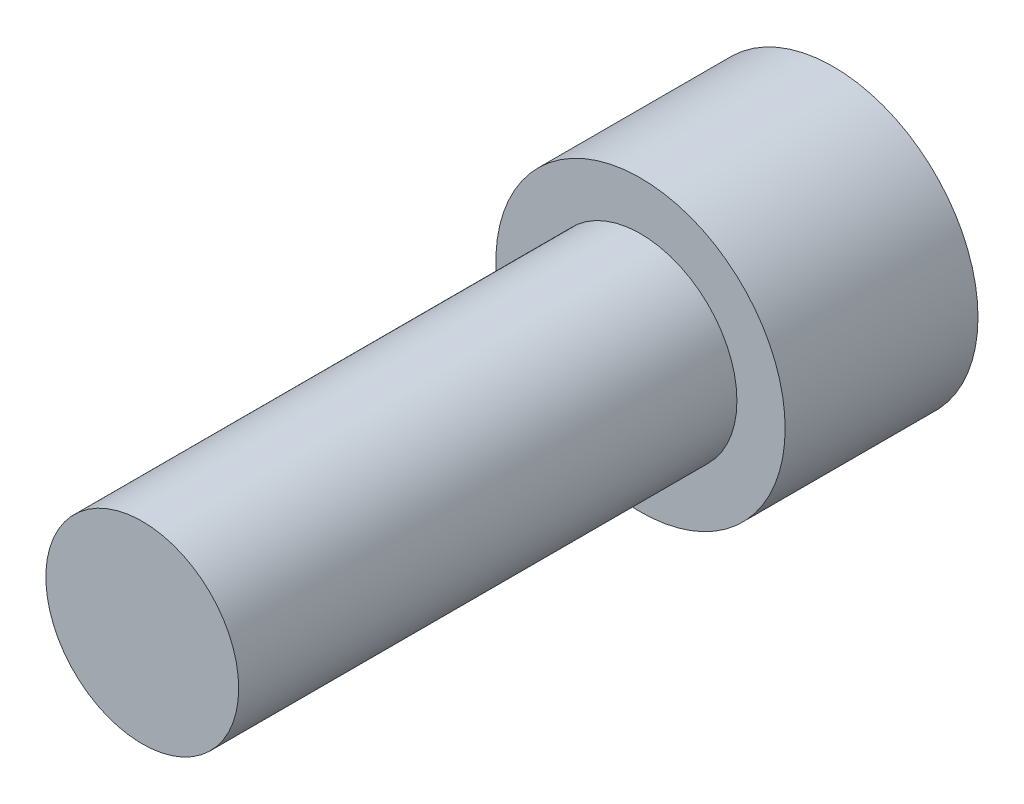
from build123d import *

# Parameters (mm, degrees)
SKETCH_1_R          = 9
EXTRUDE_1_DEPTH     = 12
SKETCH_2_R          = 6
EXTRUDE_2_DEPTH     = 31
CUT_EXTRUDE_1_DEPTH = 3


with BuildPart() as part:
    # ｽｹｯﾁ1 → ﾎﾞｽ - 押し出し1 (new body)
    with BuildSketch(Plane.XY):
        Circle(SKETCH_1_R)
    extrude(amount=EXTRUDE_1_DEPTH)

    # ｽｹｯﾁ2 → ﾎﾞｽ - 押し出し2 (add)
    with BuildSketch(Plane.XY.offset(12)):
        Circle(SKETCH_2_R)
    extrude(amount=EXTRUDE_2_DEPTH)

    # ｽｹｯﾁ3 → ｶｯﾄ - 押し出し1 (cut)
    with BuildSketch(Plane(origin=(0, 0, 0), x_dir=(-1, 0, 0), z_dir=(0, 0, -1))):
        Polygon((5.210888491, 4.367632677), (-1.177036607, 6.696578149), (-6.387925099, 2.328945471), (-5.210888491, -4.367632677), (1.177036607, -6.696578149), (6.387925099, -2.328945471), align=None)
    extrude(amount=-CUT_EXTRUDE_1_DEPTH, mode=Mode.SUBTRACT)


solid = part.part
